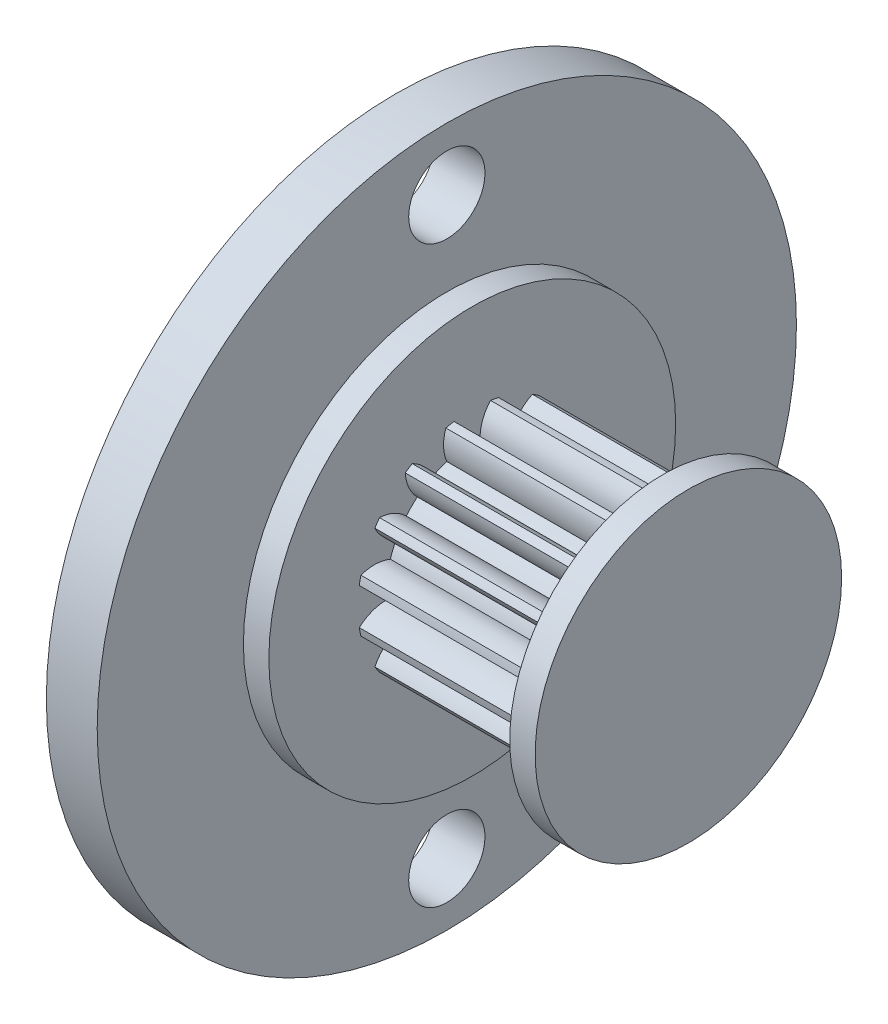
from build123d import *

# Parameters (mm, degrees)
BASPROSKE_W             = 7.5
BASPROSKE_H             = 4.5
TOOTHCUT_DEPTH          = 10.836157786
TEETHCUTS_COUNT         = 16
TEETHCUTS_ANGLE         = 337.5
BORSKE_R                = 2.5
BORE_DEPTH              = 50.0000508
ESQUISSE4_R             = 6
BOSS_EXTRU_3_DEPTH      = 1
ESQUISSE5_R             = 6.027848577
ESQUISSE5_R_2           = 2.85
BOSS_EXTRU_4_DEPTH      = 1
ESQUISSE7_R             = 3.00711341
BOSS_EXTRU_6_DEPTH      = 8.5
ESQUISSE9_R             = 13.75
ESQUISSE9_R_2           = 5.5
BOSS_EXTRU_8_DEPTH      = 2
ESQUISSE10_R            = 1.5
ENL_V_MAT_EXTRU_3_DEPTH = 23.591480695
ESQUISSE11_R            = 3
ENL_V_MAT_EXTRU_4_DEPTH = 4
BOSS_EXTRU_9_START      = 4
ESQUISSE12_R            = 3
BOSS_EXTRU_9_DEPTH      = 4
ESQUISSE13_R            = 5.5
BOSS_EXTRU_10_DEPTH     = 2
ESQUISSE16_R            = 8
BOSS_EXTRU_11_DEPTH     = 1
ESQUISSE14_R            = 6
ENL_V_MAT_EXTRU_5_DEPTH = 1.5
ESQUISSE15_R            = 3.25
ENL_V_MAT_EXTRU_6_DEPTH = 4.5


with BuildPart() as part:
    # BasProSke → Base-Revolve (revolve)
    with BuildSketch(Plane(origin=(0, 0, 0), x_dir=(1, 0, 0), z_dir=(0, 1, 0)), mode=Mode.PRIVATE) as base_revolve_sk:
        with Locations((3.75, 2.25)):
            Rectangle(BASPROSKE_W, BASPROSKE_H)
    revolve(base_revolve_sk.sketch.rotate(Axis((-10, 0, 0), (1, 0, 0)), 180), axis=Axis((-10, 0, 0), (1, 0, 0)))

    # TooCutSke → ToothCut (cut, through all)
    with BuildSketch(Plane(origin=(0, 0, 0), x_dir=(0, 0, -1), z_dir=(1, 0, 0))):
        with BuildLine():
            ThreePointArc((0.306025637, 3.360092902), (0, 3.374), (-0.306025637, 3.360092902))
            ThreePointArc((-0.306025637, 3.360092902), (-0.415941512, 3.953968919), (-0.738171669, 4.464789776))
            ThreePointArc((-0.738171669, 4.464789776), (0, 4.5254), (0.738171669, 4.464789776))
            ThreePointArc((0.738171669, 4.464789776), (0.415941512, 3.953968919), (0.306025637, 3.360092902))
        make_face()
    toothcut = extrude(amount=TOOTHCUT_DEPTH, mode=Mode.SUBTRACT)

    # TeethCuts: ToothCut ×16 about axis
    teethcuts_axis = Axis((-10, 0, 0), (1, 0, 0))
    for i in range(1, TEETHCUTS_COUNT):
        add(toothcut.rotate(teethcuts_axis, i * TEETHCUTS_ANGLE / (TEETHCUTS_COUNT - 1)), mode=Mode.SUBTRACT)

    # BorSke → Bore (cut, symmetric)
    with BuildSketch(Plane(origin=(0, 0, 0), x_dir=(0, 0, -1), z_dir=(1, 0, 0))):
        with Locations(Location((0, 0, 0), (0, 0, 180))):
            Circle(BORSKE_R)
    extrude(amount=BORE_DEPTH, both=True, mode=Mode.SUBTRACT)

    # Esquisse4 → Boss.-Extru.3 (add)
    with BuildSketch(Plane.ZY):
        Circle(ESQUISSE4_R)
    extrude(amount=BOSS_EXTRU_3_DEPTH)

    # Esquisse5 → Boss.-Extru.4 (add)
    with BuildSketch(Plane(origin=(7.5, 0, 0), x_dir=(0, 0, -1), z_dir=(1, 0, 0))):
        Circle(ESQUISSE5_R)
        Circle(ESQUISSE5_R_2, mode=Mode.SUBTRACT)
    extrude(amount=BOSS_EXTRU_4_DEPTH)

    # Esquisse7 → Boss.-Extru.6 (add)
    with BuildSketch(Plane(origin=(0, 0, 0), x_dir=(0, 0, -1), z_dir=(1, 0, 0))):
        Circle(ESQUISSE7_R)
    extrude(amount=BOSS_EXTRU_6_DEPTH)

    # Esquisse9 → Boss.-Extru.8 (add)
    with BuildSketch(Plane.ZY.offset(1)):
        Circle(ESQUISSE9_R)
        Circle(ESQUISSE9_R_2, mode=Mode.SUBTRACT)
    extrude(amount=BOSS_EXTRU_8_DEPTH)

    # Esquisse10 → Enlèv. mat.-Extru.3 (cut, through all)
    with BuildSketch(Plane.ZY.offset(3)):
        with Locations((0, 11.3)):
            Circle(ESQUISSE10_R)
        with Locations((0, -11.3)):
            Circle(ESQUISSE10_R)
    extrude(amount=-ENL_V_MAT_EXTRU_3_DEPTH, mode=Mode.SUBTRACT)

    # Esquisse11 → Enlèv. mat.-Extru.4 (cut)
    with BuildSketch(Plane.ZY.offset(1)):
        Circle(ESQUISSE11_R)
    extrude(amount=-ENL_V_MAT_EXTRU_4_DEPTH, mode=Mode.SUBTRACT)

    # Esquisse12 → Boss.-Extru.9 (add)
    with BuildSketch(Plane.ZY.offset(-3).offset(BOSS_EXTRU_9_START)):
        Circle(ESQUISSE12_R)
    extrude(amount=-BOSS_EXTRU_9_DEPTH)

    # Esquisse13 → Boss.-Extru.10 (add)
    with BuildSketch(Plane.ZY.offset(1)):
        Circle(ESQUISSE13_R)
    extrude(amount=BOSS_EXTRU_10_DEPTH)

    # Esquisse16 → Boss.-Extru.11 (add)
    with BuildSketch(Plane(origin=(-1, 0, 0), x_dir=(0, 0, -1), z_dir=(1, 0, 0))):
        with Locations(Location((0, 0, 0), (0, 0, 180))):
            Circle(ESQUISSE16_R)
    extrude(amount=BOSS_EXTRU_11_DEPTH)

    # Esquisse14 → Enlèv. mat.-Extru.5 (cut)
    with BuildSketch(Plane.ZY.offset(3)):
        Circle(ESQUISSE14_R)
    extrude(amount=-ENL_V_MAT_EXTRU_5_DEPTH, mode=Mode.SUBTRACT)

    # Esquisse15 → Enlèv. mat.-Extru.6 (cut)
    with BuildSketch(Plane.ZY.offset(1.5)):
        Circle(ESQUISSE15_R)
    extrude(amount=-ENL_V_MAT_EXTRU_6_DEPTH, mode=Mode.SUBTRACT)


solid = part.part
